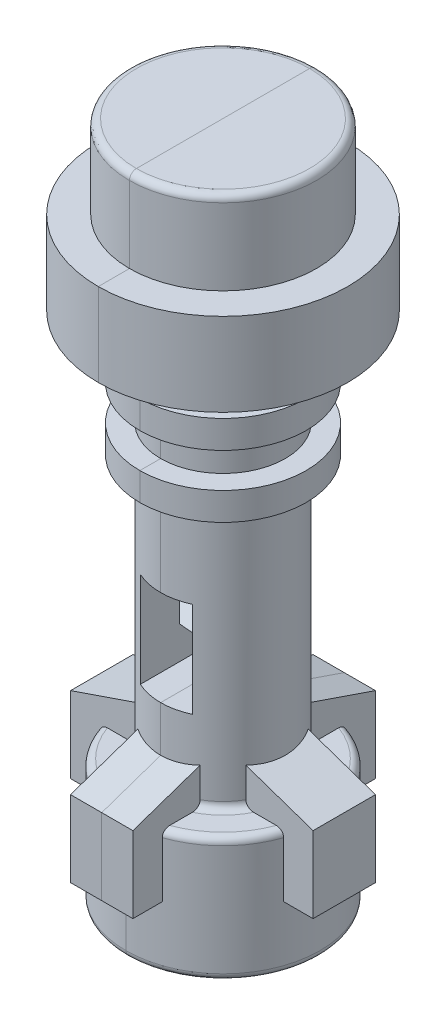
from build123d import *

# Parameters (mm, degrees)
SKETCH1_R               = 4.5
BOSS_EXTRUDE1_DEPTH     = 19
SKETCH2_R               = 7
BOSS_EXTRUDE2_DEPTH     = 9
SKETCH3_R               = 6
BOSS_EXTRUDE3_DEPTH     = 2
SKETCH4_R               = 4.5
BOSS_EXTRUDE4_DEPTH     = 2.5
SKETCH5_R               = 6
BOSS_EXTRUDE5_DEPTH     = 2
SKETCH6_R               = 4.5
BOSS_EXTRUDE6_DEPTH     = 2.5
SKETCH7_R               = 9
BOSS_EXTRUDE7_DEPTH     = 6
SKETCH8_R               = 6.75
BOSS_EXTRUDE8_DEPTH     = 6
BOSS_EXTRUDE9_DEPTH     = 2.25
CIRPATTERN1_COUNT       = 2
CIRPATTERN1_ANGLE       = 90
FILLET1_R               = 0.5
FILLET3_R               = 0.5
SCALE3_SCALE            = 3.2
CUT_EXTRUDE1_DEPTH      = 135.323787916
CUT_EXTRUDE1_DEPTH_BACK = 135.323787916
SKETCH14_W              = 12
SKETCH14_H              = 22
CUT_EXTRUDE3_DEPTH      = 135.323787916


with BuildPart() as part:
    # Sketch1 → Boss-Extrude1 (new body)
    with BuildSketch(Plane(origin=(0, 0, 0), x_dir=(1, 0, 0), z_dir=(0, 1, 0))):
        Circle(SKETCH1_R)
    extrude(amount=BOSS_EXTRUDE1_DEPTH)

    # Sketch2 → Boss-Extrude2 (add)
    with BuildSketch(Plane.XZ):
        Circle(SKETCH2_R)
    extrude(amount=BOSS_EXTRUDE2_DEPTH)

    # Sketch3 → Boss-Extrude3 (add)
    with BuildSketch(Plane(origin=(0, 19, 0), x_dir=(1, 0, 0), z_dir=(0, 1, 0))):
        Circle(SKETCH3_R)
    extrude(amount=BOSS_EXTRUDE3_DEPTH)

    # Sketch4 → Boss-Extrude4 (add)
    with BuildSketch(Plane(origin=(0, 21, 0), x_dir=(1, 0, 0), z_dir=(0, 1, 0))):
        Circle(SKETCH4_R)
    extrude(amount=BOSS_EXTRUDE4_DEPTH)

    # Sketch5 → Boss-Extrude5 (add)
    with BuildSketch(Plane(origin=(0, 23.5, 0), x_dir=(1, 0, 0), z_dir=(0, 1, 0))):
        Circle(SKETCH5_R)
    extrude(amount=BOSS_EXTRUDE5_DEPTH)

    # Sketch6 → Boss-Extrude6 (add)
    with BuildSketch(Plane(origin=(0, 25.5, 0), x_dir=(1, 0, 0), z_dir=(0, 1, 0))):
        Circle(SKETCH6_R)
    extrude(amount=BOSS_EXTRUDE6_DEPTH)

    # Sketch7 → Boss-Extrude7 (add)
    with BuildSketch(Plane(origin=(0, 28, 0), x_dir=(1, 0, 0), z_dir=(0, 1, 0))):
        Circle(SKETCH7_R)
    extrude(amount=BOSS_EXTRUDE7_DEPTH)

    # Sketch8 → Boss-Extrude8 (add)
    with BuildSketch(Plane(origin=(0, 34, 0), x_dir=(1, 0, 0), z_dir=(0, 1, 0))):
        Circle(SKETCH8_R)
    extrude(amount=BOSS_EXTRUDE8_DEPTH)

    # Sketch10 → Boss-Extrude9 (add, symmetric)
    with BuildSketch(Plane(origin=(0, 0, 0), x_dir=(0, 0, -1), z_dir=(1, 0, 0))):
        Polygon((-8.75, -4.5), (8.75, -4.5), (8.75, 1), (0, 4), (-8.75, 1), align=None)
    boss_extrude9 = extrude(amount=BOSS_EXTRUDE9_DEPTH, both=True)

    # CirPattern1: Boss-Extrude9 ×2 about axis
    cirpattern1_axis = Axis((0, 19, 0), (0, -1, 0))
    for i in range(1, CIRPATTERN1_COUNT):
        add(boss_extrude9.rotate(cirpattern1_axis, i * CIRPATTERN1_ANGLE / (CIRPATTERN1_COUNT - 1)))

    # Fillet1
    fillet1_edges = [part.edges().sort_by_distance(p)[0] for p in [
        (4.949747468, 0, -4.949747468),
        (-4.949747468, 0, -4.949747468),
        (-4.949747468, 0, 4.949747468),
        (-7, -9, 0),
        (4.949747468, 0, 4.949747468),
        (-3.181980515, 0, -3.181980515),
        (3.181980515, 0, -3.181980515),
        (3.181980515, 0, 3.181980515),
        (-3.181980515, 0, 3.181980515),
    ]]
    fillet(fillet1_edges, radius=FILLET1_R)

    # Fillet3
    fillet3_edges = [part.edges().sort_by_distance(p)[0] for p in [
        (-6.75, 40, 0),
    ]]
    fillet(fillet3_edges, radius=FILLET3_R)


with BuildPart() as part_1:
    # Scale3: scaled about (0, 0, 0)
    add(part.part.scale(SCALE3_SCALE))

    # Sketch14 → Cut-Extrude1 (cut, two sides: drawn at the far end of the back side and taken through both)
    with BuildSketch(Plane.XY.offset(-CUT_EXTRUDE1_DEPTH_BACK)):
        with Locations((0, 29.4)):
            Rectangle(SKETCH14_W, SKETCH14_H)
    extrude(amount=CUT_EXTRUDE1_DEPTH + CUT_EXTRUDE1_DEPTH_BACK, mode=Mode.SUBTRACT)

    # Sketch17 → Cut-Extrude3 (cut, through all)
    with BuildSketch(Plane(origin=(0, 0, 0), x_dir=(0, 0, -1), z_dir=(1, 0, 0))):
        Polygon((0, 40.404265283), (-4.053541246, 35.980601263), (-4.053541246, 25.980601263), (0, 21.556937242), (4.053541246, 25.980601263), (4.053541246, 35.980601263), align=None)
    extrude(amount=-CUT_EXTRUDE3_DEPTH, mode=Mode.SUBTRACT)


with BuildPart() as body_2:
    # Split1: the piece on the far side of the plane
    add(part_1.part)
    split(bisect_by=Plane(origin=(0, 0, 0), x_dir=(0, 0, 1), z_dir=(1, 0, 0)), keep=Keep.BOTTOM)


with BuildPart() as part_2:
    add(part_1.part)

    # Split1
    split(bisect_by=Plane(origin=(0, 0, 0), x_dir=(0, 0, 1), z_dir=(1, 0, 0)), keep=Keep.TOP)


solid = Compound([body_2.part, part_2.part])
